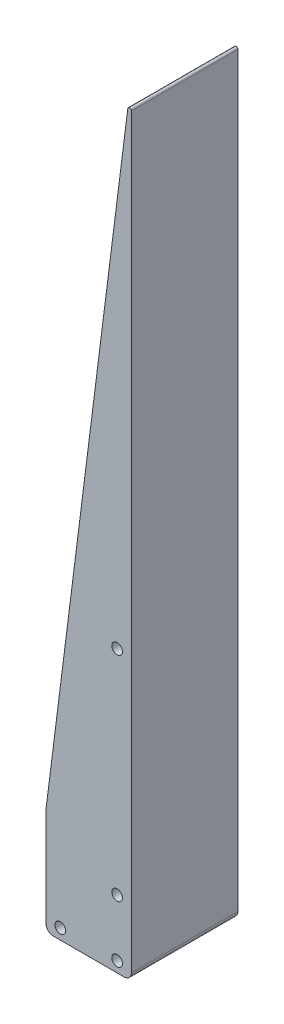
from build123d import *

# Parameters (mm, degrees)
SKETCH_1_R          = 1.5
EXTRUDE_2_DEPTH     = 30
SKETCH_2_R          = 1.5
CUT_EXTRUDE_1_DEPTH = 216.996068062


with BuildPart() as part:
    # 草图1 → 凸台-拉伸2 (new body)
    with BuildSketch(Plane.XY):
        with BuildLine():
            Line((23.003941811, 212.114539339), (0.015767245, 30.124824021))
            ThreePointArc((0.015767245, 30.124824021), (0.003945703, 29.999751784), (0, 29.874184094))
            Line((0, 29.874184094), (0, 2))
            ThreePointArc((0, 2), (0.585786438, 0.585786438), (2, 0))
            Line((2, 0), (22, 0))
            ThreePointArc((22, 0), (23.414213562, 0.585786438), (24, 2))
            Line((24, 2), (24, 212.051879357))
            ThreePointArc((24, 212.051879357), (23.531391922, 212.550892931), (23.003941811, 212.114539339))
        make_face()
        with Locations((20, 3)):
            Circle(SKETCH_1_R, mode=Mode.SUBTRACT)
        with Locations((4, 3)):
            Circle(SKETCH_1_R, mode=Mode.SUBTRACT)
        with Locations((20, 19)):
            Circle(SKETCH_1_R, mode=Mode.SUBTRACT)
    extrude(amount=EXTRUDE_2_DEPTH)

    # 草图2 → 切除-拉伸1 (cut, through all)
    with BuildSketch(Plane(origin=(0, 0, 0), x_dir=(-1, 0, 0), z_dir=(0, 0, -1))):
        with Locations((-20, 79)):
            Circle(SKETCH_2_R)
    extrude(amount=-CUT_EXTRUDE_1_DEPTH, mode=Mode.SUBTRACT)


solid = part.part
